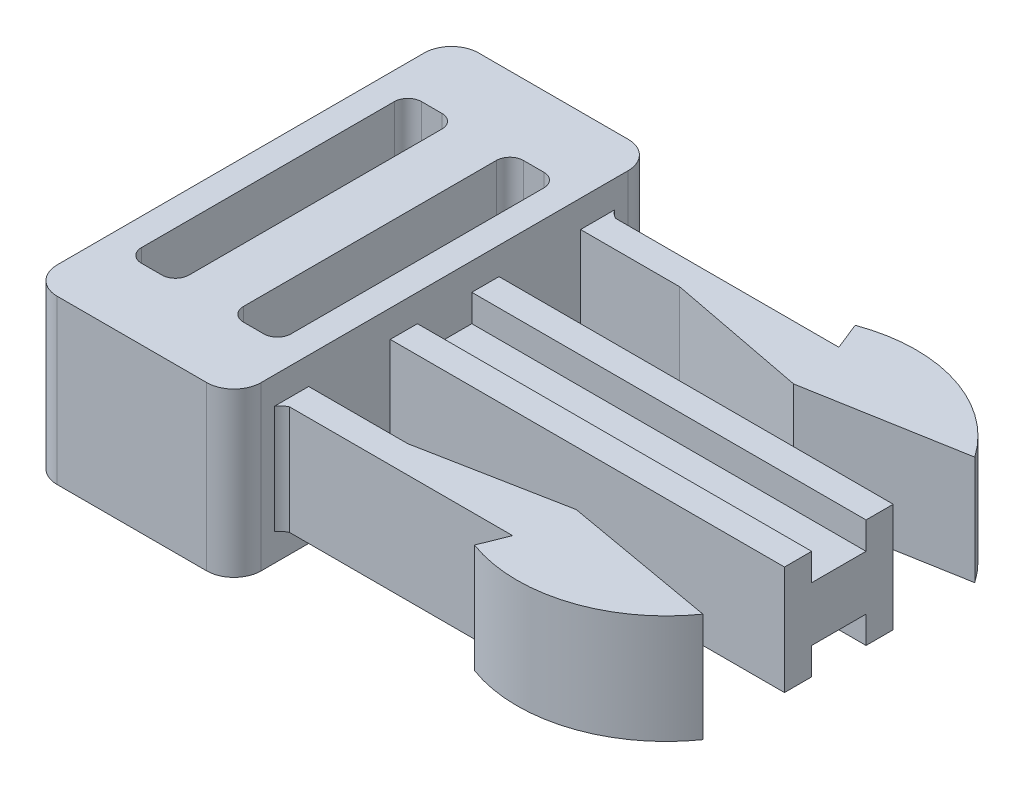
from build123d import *

# Parameters (mm, degrees)
BOSS_EXTRUDE1_DEPTH = 15.24
CUT_EXTRUDE1_DEPTH  = 47.315839623
SKETCH5_W           = 36.83
SKETCH5_H           = 10.16
BOSS_EXTRUDE2_DEPTH = 10.16
SKETCH7_W           = 36.83
SKETCH7_H           = 5.08
CUT_EXTRUDE2_DEPTH  = 2.54


with BuildPart() as part:
    # Sketch1 → Boss-Extrude1 (new body)
    with BuildSketch(Plane(origin=(0, 0, 0), x_dir=(1, 0, 0), z_dir=(0, 1, 0))):
        with BuildLine():
            Line((19.05, 36.83), (19.05, 2.54))
            ThreePointArc((19.05, 2.54), (18.306051224, 0.743948776), (16.51, 0))
            Line((16.51, 0), (2.54, 0))
            ThreePointArc((2.54, 0), (0.743948776, 0.743948776), (0, 2.54))
            Line((0, 2.54), (0, 36.83))
            ThreePointArc((0, 36.83), (0.743948776, 38.626051224), (2.54, 39.37))
            Line((2.54, 39.37), (16.51, 39.37))
            ThreePointArc((16.51, 39.37), (18.306051224, 38.626051224), (19.05, 36.83))
        make_face()
    extrude(amount=BOSS_EXTRUDE1_DEPTH)

    # Sketch3 → Cut-Extrude1 (cut, through all)
    with BuildSketch(Plane(origin=(0, 15.24, 0), x_dir=(1, 0, 0), z_dir=(0, 1, 0))):
        with BuildLine():
            Line((6.985, 31.496), (6.985, 7.874))
            ThreePointArc((6.985, 7.874), (6.613025612, 6.975974388), (5.715, 6.604))
            Line((5.715, 6.604), (3.81, 6.604))
            ThreePointArc((3.81, 6.604), (2.911974388, 6.975974388), (2.54, 7.874))
            Line((2.54, 7.874), (2.54, 31.496))
            ThreePointArc((2.54, 31.496), (2.911974388, 32.394025612), (3.81, 32.766))
            Line((3.81, 32.766), (5.715, 32.766))
            ThreePointArc((5.715, 32.766), (6.613025612, 32.394025612), (6.985, 31.496))
        make_face()
        with BuildLine():
            Line((12.065, 31.496), (12.065, 7.874))
            ThreePointArc((12.065, 7.874), (12.436974388, 6.975974388), (13.335, 6.604))
            Line((13.335, 6.604), (15.24, 6.604))
            ThreePointArc((15.24, 6.604), (16.138025612, 6.975974388), (16.51, 7.874))
            Line((16.51, 7.874), (16.51, 31.496))
            ThreePointArc((16.51, 31.496), (16.138025612, 32.394025612), (15.24, 32.766))
            Line((15.24, 32.766), (13.335, 32.766))
            ThreePointArc((13.335, 32.766), (12.436974388, 32.394025612), (12.065, 31.496))
        make_face()
    extrude(amount=-CUT_EXTRUDE1_DEPTH, mode=Mode.SUBTRACT)

    # Sketch5 → Boss-Extrude2 (add)
    with BuildSketch(Plane(origin=(0, 2.54, 0), x_dir=(1, 0, 0), z_dir=(0, 1, 0))):
        with BuildLine():
            Line((19.795155373, 34.925), (40.64, 34.925))
            Line((40.64, 34.925), (39.624, 37.465))
            ThreePointArc((39.624, 37.465), (48.617910258, 37.695912826), (55.88, 32.385))
            Line((55.88, 32.385), (41.501589711, 29.845))
            Line((41.501589711, 29.845), (28.302846613, 32.385))
            Line((28.302846613, 32.385), (19.338620701, 32.385))
            Line((19.338620701, 32.385), (19.05, 32.385))
            Line((19.05, 32.385), (19.05, 35.56))
            ThreePointArc((19.05, 35.56), (19.381676592, 35.194503669), (19.795155373, 34.925))
        make_face()
        with Locations((37.465, 19.685)):
            Rectangle(SKETCH5_W, SKETCH5_H)
        with BuildLine():
            Line((19.795155373, 4.445), (40.64, 4.445))
            Line((40.64, 4.445), (39.624, 1.905))
            ThreePointArc((39.624, 1.905), (48.617910258, 1.674087174), (55.88, 6.985))
            Line((55.88, 6.985), (41.501589711, 9.525))
            Line((41.501589711, 9.525), (28.302846613, 6.985))
            Line((28.302846613, 6.985), (19.338620701, 6.985))
            Line((19.338620701, 6.985), (19.05, 6.985))
            Line((19.05, 6.985), (19.05, 3.81))
            ThreePointArc((19.05, 3.81), (19.381676592, 4.175496331), (19.795155373, 4.445))
        make_face()
    extrude(amount=BOSS_EXTRUDE2_DEPTH)

    # Sketch7 → Cut-Extrude2 (cut)
    with BuildSketch(Plane(origin=(0, 12.7, 0), x_dir=(1, 0, 0), z_dir=(0, 1, 0))):
        with Locations((37.465, 19.685)):
            Rectangle(SKETCH7_W, SKETCH7_H)
    cut_extrude2 = extrude(amount=-CUT_EXTRUDE2_DEPTH, mode=Mode.SUBTRACT)

    # Mirror1: Cut-Extrude2 across plane
    add(cut_extrude2.mirror(Plane.ZX.offset(7.62)), mode=Mode.SUBTRACT)


solid = part.part
